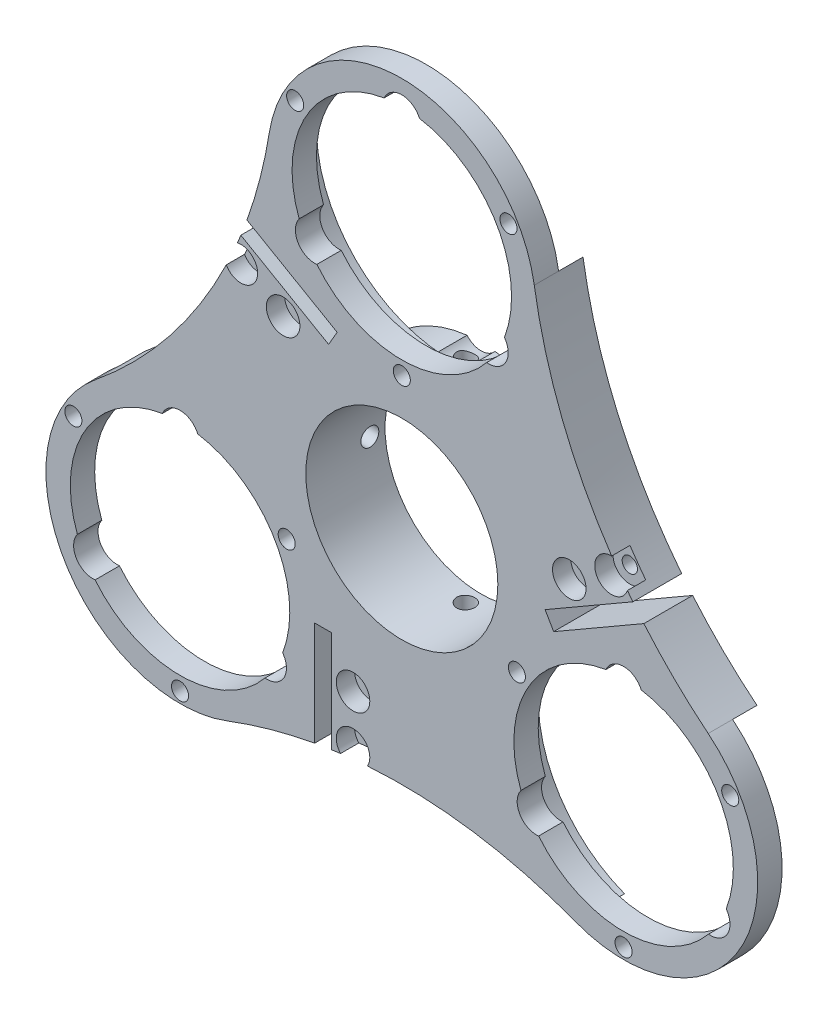
from build123d import *

# Parameters (mm, degrees)
SKETCH_1_R           = 20
SKETCH_1_R_2         = 15.75
EXTRUDE_1_DEPTH      = 5
EXTRUDE_2_DEPTH      = 8
SKETCH_3_R           = 18
EXTRUDE_3_DEPTH      = 12
EXTRUDE_6_DEPTH      = 8
SKETCH_4_R           = 15
CUT_EXTRUDE_1_DEPTH  = 16
SKETCH_7_R           = 2
CUT_EXTRUDE_2_DEPTH  = 10
EXTRUDE_7_REACH      = 92.158
SKETCH_10_W          = 1.475
SKETCH_10_H          = 47.880376143
SKETCH_11_W          = 47.783072431
SKETCH_11_H          = 1.475
SKETCH_14_R          = 15.75
CUT_EXTRUDE_6_DEPTH  = 8
CUT_EXTRUDE_8_DEPTH  = 25
CUT_EXTRUDE_START    = 4
SKETCH_17_R          = 22
CUT_EXTRUDE_9_DEPTH  = 4
SKETCH_18_R          = 1.4
CUT_EXTRUDE_10_DEPTH = 4
SKETCH_19_R          = 3
CUT_EXTRUDE_11_DEPTH = 5
SKETCH_20_R          = 1.25
CUT_EXTRUDE_13_DEPTH = 10
SKETCH_21_R          = 2.75
CUT_EXTRUDE_14_DEPTH = 3
SKETCH_22_W          = 2.8
SKETCH_22_H          = 26.724621274
CUT_EXTRUDE_15_DEPTH = 10


with BuildPart() as part:
    # 草图1 → 凸台-拉伸1 (new body)
    with BuildSketch(Plane.XY):
        Circle(SKETCH_1_R)
        Circle(SKETCH_1_R_2, mode=Mode.SUBTRACT)
    extrude(amount=EXTRUDE_1_DEPTH)

    # 草图2 → 凸台-拉伸2 (add)
    with BuildSketch(Plane.XY.offset(5)):
        with BuildLine():
            ThreePointArc((0, -25.892443989), (42.435244785, -24.5), (22.423514261, 12.946221995))
            ThreePointArc((22.423514261, 12.946221995), (0, 49), (-22.423514261, 12.946221995))
            ThreePointArc((-22.423514261, 12.946221995), (-42.435244785, -24.5), (0, -25.892443989))
        make_face()
    extrude(amount=EXTRUDE_2_DEPTH)

    # 草图3 → 凸台-拉伸3 (add)
    with BuildSketch(Plane.XY.offset(13)):
        with Locations(Location((0, 42, 0), (0, 0, 182.034073739))):
            Circle(SKETCH_3_R)
        with Locations(Location((36.373066959, -21, 0), (0, 0, 237.965926261))):
            Circle(SKETCH_3_R)
        with Locations(Location((-36.373066959, -21, 0), (0, 0, 117.965926261))):
            Circle(SKETCH_3_R)
    extrude(amount=EXTRUDE_3_DEPTH)

    # 草图8 → 凸台-拉伸6 (add)
    with BuildSketch(Plane(origin=(0, 0, 5), x_dir=(-1, 0, 0), z_dir=(0, 0, -1))):
        with BuildLine():
            ThreePointArc((28.527895654, -41.553668461), (55.425625842, -32), (50.250480335, -3.929048123))
            ThreePointArc((50.250480335, -3.929048123), (31.431769398, 18.147140523), (21.72258468, 45.482716583))
            ThreePointArc((21.72258468, 45.482716583), (0, 64), (-21.72258468, 45.482716583))
            ThreePointArc((-21.72258468, 45.482716583), (-31.431769398, 18.147140523), (-50.250480335, -3.929048123))
            ThreePointArc((-50.250480335, -3.929048123), (-55.425625842, -32), (-28.527895654, -41.553668461))
            ThreePointArc((-28.527895654, -41.553668461), (0, -36.294281046), (28.527895654, -41.553668461))
        make_face()
        with BuildLine():
            ThreePointArc((22.423514261, 12.946221995), (42.435244785, -24.5), (0, -25.892443989))
            ThreePointArc((0, -25.892443989), (-42.435244785, -24.5), (-22.423514261, 12.946221995))
            ThreePointArc((-22.423514261, 12.946221995), (0, 49), (22.423514261, 12.946221995))
        make_face(mode=Mode.SUBTRACT)
    extrude(amount=-EXTRUDE_6_DEPTH)

    # 草图4 → 切除-拉伸1 (cut)
    with BuildSketch(Plane.XY.offset(25)):
        with Locations((0, 42)):
            Circle(SKETCH_4_R)
        with Locations((36.373066959, -21)):
            Circle(SKETCH_4_R)
        with Locations((-36.373066959, -21)):
            Circle(SKETCH_4_R)
    extrude(amount=-CUT_EXTRUDE_1_DEPTH, mode=Mode.SUBTRACT)

    # 草图7 → 切除-拉伸2 (cut)
    with BuildSketch(Plane.XY.offset(9)):
        with Locations((0, 42)):
            Circle(SKETCH_7_R)
        with Locations((36.373066959, -21)):
            Circle(SKETCH_7_R)
        with Locations((-36.373066959, -21)):
            Circle(SKETCH_7_R)
    extrude(amount=-CUT_EXTRUDE_2_DEPTH, mode=Mode.SUBTRACT)

    # 草图6 → 凸台-拉伸7 (add, up to next)
    with BuildSketch(Plane.XY.offset(25), mode=Mode.PRIVATE) as extrude_7_sk1:
        with BuildLine():
            ThreePointArc((2.644358031, 56.765072658), (0, 61.66268909), (-2.644358031, 56.765072658))
            ThreePointArc((-2.644358031, 56.765072658), (0, 57), (2.644358031, 56.765072658))
        make_face()
    extrude_7_tool1 = extrude(extrude_7_sk1.sketch, amount=-EXTRUDE_7_REACH, mode=Mode.PRIVATE) - part.part
    # 草图6 → 凸台-拉伸7 (add, up to next)
    with BuildSketch(Plane.XY.offset(25), mode=Mode.PRIVATE) as extrude_7_sk2:
        with BuildLine():
            ThreePointArc((11.464748995, 32.327382439), (17.028388258, 32.168655455), (14.109107026, 36.907544902))
            ThreePointArc((14.109107026, 36.907544902), (12.990381057, 34.5), (11.464748995, 32.327382439))
        make_face()
    extrude_7_tool2 = extrude(extrude_7_sk2.sketch, amount=-EXTRUDE_7_REACH, mode=Mode.PRIVATE) - part.part
    # 草图6 → 凸台-拉伸7 (add, up to next)
    with BuildSketch(Plane.XY.offset(25), mode=Mode.PRIVATE) as extrude_7_sk3:
        with BuildLine():
            ThreePointArc((-14.109107026, 36.907544902), (-17.028388258, 32.168655455), (-11.464748995, 32.327382439))
            ThreePointArc((-11.464748995, 32.327382439), (-12.990381057, 34.5), (-14.109107026, 36.907544902))
        make_face()
    extrude_7_tool3 = extrude(extrude_7_sk3.sketch, amount=-EXTRUDE_7_REACH, mode=Mode.PRIVATE) - part.part
    # 草图6 → 凸台-拉伸7 (add, up to next)
    with BuildSketch(Plane.XY.offset(25), mode=Mode.PRIVATE) as extrude_7_sk4:
        with BuildLine():
            ThreePointArc((47.837815954, -30.672617561), (53.401455217, -30.831344545), (50.482173985, -26.092455098))
            ThreePointArc((50.482173985, -26.092455098), (49.363448016, -28.5), (47.837815954, -30.672617561))
        make_face()
    extrude_7_tool4 = extrude(extrude_7_sk4.sketch, amount=-EXTRUDE_7_REACH, mode=Mode.PRIVATE) - part.part
    # 草图6 → 凸台-拉伸7 (add, up to next)
    with BuildSketch(Plane.XY.offset(25), mode=Mode.PRIVATE) as extrude_7_sk5:
        with BuildLine():
            ThreePointArc((22.263959933, -26.092455098), (19.344678701, -30.831344545), (24.908317964, -30.672617561))
            ThreePointArc((24.908317964, -30.672617561), (23.382685902, -28.5), (22.263959933, -26.092455098))
        make_face()
    extrude_7_tool5 = extrude(extrude_7_sk5.sketch, amount=-EXTRUDE_7_REACH, mode=Mode.PRIVATE) - part.part
    # 草图6 → 凸台-拉伸7 (add, up to next)
    with BuildSketch(Plane.XY.offset(25), mode=Mode.PRIVATE) as extrude_7_sk6:
        with BuildLine():
            ThreePointArc((39.01742499, -6.234927342), (36.373066959, -1.33731091), (33.728708928, -6.234927342))
            ThreePointArc((33.728708928, -6.234927342), (36.373066959, -6), (39.01742499, -6.234927342))
        make_face()
    extrude_7_tool6 = extrude(extrude_7_sk6.sketch, amount=-EXTRUDE_7_REACH, mode=Mode.PRIVATE) - part.part
    # 草图6 → 凸台-拉伸7 (add, up to next)
    with BuildSketch(Plane.XY.offset(25), mode=Mode.PRIVATE) as extrude_7_sk7:
        with BuildLine():
            ThreePointArc((-50.482173985, -26.092455098), (-53.401455217, -30.831344545), (-47.837815954, -30.672617561))
            ThreePointArc((-47.837815954, -30.672617561), (-49.363448016, -28.5), (-50.482173985, -26.092455098))
        make_face()
    extrude_7_tool7 = extrude(extrude_7_sk7.sketch, amount=-EXTRUDE_7_REACH, mode=Mode.PRIVATE) - part.part
    # 草图6 → 凸台-拉伸7 (add, up to next)
    with BuildSketch(Plane.XY.offset(25), mode=Mode.PRIVATE) as extrude_7_sk8:
        with BuildLine():
            ThreePointArc((-33.728708928, -6.234927342), (-36.373066959, -1.33731091), (-39.01742499, -6.234927342))
            ThreePointArc((-39.01742499, -6.234927342), (-36.373066959, -6), (-33.728708928, -6.234927342))
        make_face()
    extrude_7_tool8 = extrude(extrude_7_sk8.sketch, amount=-EXTRUDE_7_REACH, mode=Mode.PRIVATE) - part.part
    # 草图6 → 凸台-拉伸7 (add, up to next)
    with BuildSketch(Plane.XY.offset(25), mode=Mode.PRIVATE) as extrude_7_sk9:
        with BuildLine():
            ThreePointArc((-24.908317964, -30.672617561), (-19.344678701, -30.831344545), (-22.263959933, -26.092455098))
            ThreePointArc((-22.263959933, -26.092455098), (-23.382685902, -28.5), (-24.908317964, -30.672617561))
        make_face()
    extrude_7_tool9 = extrude(extrude_7_sk9.sketch, amount=-EXTRUDE_7_REACH, mode=Mode.PRIVATE) - part.part
    add(extrude_7_tool1.solids().sort_by_distance((0, 59.041522, 25))[0])
    add(extrude_7_tool2.solids().sort_by_distance((14.758391, 33.479239, 25))[0])
    add(extrude_7_tool3.solids().sort_by_distance((-14.758391, 33.479239, 25))[0])
    add(extrude_7_tool4.solids().sort_by_distance((51.131457, -29.520761, 25))[0])
    add(extrude_7_tool5.solids().sort_by_distance((21.614676, -29.520761, 25))[0])
    add(extrude_7_tool6.solids().sort_by_distance((36.373067, -3.958478, 25))[0])
    add(extrude_7_tool7.solids().sort_by_distance((-51.131457, -29.520761, 25))[0])
    add(extrude_7_tool8.solids().sort_by_distance((-36.373067, -3.958478, 25))[0])
    add(extrude_7_tool9.solids().sort_by_distance((-21.614676, -29.520761, 25))[0])

    # 草图10 → 切除-旋转1 (revolve, cut)
    with BuildSketch(Plane(origin=(0, 0, 2.5), x_dir=(-1, 0, 0), z_dir=(0, 0, -1)), mode=Mode.PRIVATE) as cut_revolve_1_sk:
        with Locations((0.7375, -0.269128361)):
            Rectangle(SKETCH_10_W, SKETCH_10_H)
    revolve(cut_revolve_1_sk.sketch.rotate(Axis((0, 26.597082696, 2.5), (0, -1, 0)), 270), axis=Axis((0, 26.597082696, 2.5), (0, -1, 0)), mode=Mode.SUBTRACT)

    # 草图11 → 切除-旋转2 (revolve, cut)
    with BuildSketch(Plane(origin=(0, 0, 2.5), x_dir=(-1, 0, 0), z_dir=(0, 0, -1)), mode=Mode.PRIVATE) as cut_revolve_2_sk:
        with Locations((0.227220258, 0.7375)):
            Rectangle(SKETCH_11_W, SKETCH_11_H)
    revolve(cut_revolve_2_sk.sketch.rotate(Axis((35.344622551, 0, 2.5), (-1, 0, 0)), 90), axis=Axis((35.344622551, 0, 2.5), (-1, 0, 0)), mode=Mode.SUBTRACT)

    # 草图14 → 切除-拉伸6 (cut)
    with BuildSketch(Plane(origin=(0, 0, 5), x_dir=(-1, 0, 0), z_dir=(0, 0, -1))):
        with Locations(Location((0, 0, 0), (0, 0, 180))):
            Circle(SKETCH_14_R)
    extrude(amount=-CUT_EXTRUDE_6_DEPTH, mode=Mode.SUBTRACT)

    # 草图16 → 切除-拉伸8 (cut, symmetric)
    with BuildSketch(Plane.XY.offset(13)):
        with BuildLine():
            ThreePointArc((-2.89865373, 59.765072658), (-15.588457268, 51), (-16.834331087, 35.627771438))
            ThreePointArc((-16.834331087, 35.627771438), (-17.028388258, 32.168655455), (-13.935677357, 30.607155904))
            ThreePointArc((-13.935677357, 30.607155904), (0, 24), (13.935677357, 30.607155904))
            ThreePointArc((13.935677357, 30.607155904), (17.028388258, 32.168655455), (16.834331087, 35.627771438))
            ThreePointArc((16.834331087, 35.627771438), (15.588457268, 51), (2.89865373, 59.765072658))
            ThreePointArc((2.89865373, 59.765072658), (0, 61.66268909), (-2.89865373, 59.765072658))
        make_face()
        with BuildLine():
            ThreePointArc((53.207398046, -27.372228562), (51.961524227, -12), (39.271720689, -3.234927342))
            ThreePointArc((39.271720689, -3.234927342), (36.373066959, -1.33731091), (33.474413229, -3.234927342))
            ThreePointArc((33.474413229, -3.234927342), (20.784609691, -12), (19.538735872, -27.372228562))
            ThreePointArc((19.538735872, -27.372228562), (19.344678701, -30.831344545), (22.437389602, -32.392844096))
            ThreePointArc((22.437389602, -32.392844096), (36.373066959, -39), (50.308744316, -32.392844096))
            ThreePointArc((50.308744316, -32.392844096), (53.401455217, -30.831344545), (53.207398046, -27.372228562))
        make_face()
        with BuildLine():
            ThreePointArc((-50.308744316, -32.392844096), (-36.373066959, -39), (-22.437389602, -32.392844096))
            ThreePointArc((-22.437389602, -32.392844096), (-19.344678701, -30.831344545), (-19.538735872, -27.372228562))
            ThreePointArc((-19.538735872, -27.372228562), (-20.784609691, -12), (-33.474413229, -3.234927342))
            ThreePointArc((-33.474413229, -3.234927342), (-36.373066959, -1.33731091), (-39.271720689, -3.234927342))
            ThreePointArc((-39.271720689, -3.234927342), (-51.961524227, -12), (-53.207398046, -27.372228562))
            ThreePointArc((-53.207398046, -27.372228562), (-53.401455217, -30.831344545), (-50.308744316, -32.392844096))
        make_face()
    extrude(amount=CUT_EXTRUDE_8_DEPTH, both=True, mode=Mode.SUBTRACT)

    # 草图17 → 切除-拉伸9 (cut)
    with BuildSketch(Plane(origin=(0, 0, 9), x_dir=(-1, 0, 0), z_dir=(0, 0, -1)).offset(CUT_EXTRUDE_START)):
        with Locations((0, 42)):
            Circle(SKETCH_17_R)
        with Locations((36.373066959, -21)):
            Circle(SKETCH_17_R)
        with Locations((-36.373066959, -21)):
            Circle(SKETCH_17_R)
    extrude(amount=-CUT_EXTRUDE_9_DEPTH, mode=Mode.SUBTRACT)

    # 草图18 → 切除-拉伸10 (cut)
    with BuildSketch(Plane(origin=(0, 0, 9), x_dir=(-1, 0, 0), z_dir=(0, 0, -1))):
        with Locations((0, 21.8)):
            Circle(SKETCH_18_R)
        with Locations((-17.493713156, 52.1)):
            Circle(SKETCH_18_R)
        with Locations((17.493713156, 52.1)):
            Circle(SKETCH_18_R)
        with Locations((53.866780115, -10.9)):
            Circle(SKETCH_18_R)
        with Locations((36.373066959, -41.2)):
            Circle(SKETCH_18_R)
        with Locations((18.879353803, -10.9)):
            Circle(SKETCH_18_R)
        with Locations((-36.373066959, -41.2)):
            Circle(SKETCH_18_R)
        with Locations((-53.866780115, -10.9)):
            Circle(SKETCH_18_R)
        with Locations((-18.879353802, -10.9)):
            Circle(SKETCH_18_R)
    extrude(amount=-CUT_EXTRUDE_10_DEPTH, mode=Mode.SUBTRACT)

    # 草图19 → 切除-拉伸11 (cut)
    with BuildSketch(Plane(origin=(0, 0, 0), x_dir=(-1, 0, 0), z_dir=(0, 0, -1))):
        with Locations((0, 21.8)):
            Circle(SKETCH_19_R)
        with Locations((18.879353803, -10.9)):
            Circle(SKETCH_19_R)
        with Locations((-18.879353802, -10.9)):
            Circle(SKETCH_19_R)
    extrude(amount=-CUT_EXTRUDE_11_DEPTH, mode=Mode.SUBTRACT)

    # 草图20 → 切除-拉伸13 (cut)
    with BuildSketch(Plane(origin=(0, 0, 5), x_dir=(-1, 0, 0), z_dir=(0, 0, -1))):
        with Locations((8, -35.096730742)):
            Circle(SKETCH_20_R)
        with Locations((8, -27.096730742)):
            Circle(SKETCH_20_R)
        with Locations((-27.466457182, 6.620162141)):
            Circle(SKETCH_20_R)
        with Locations((-34.394660412, 10.620162141)):
            Circle(SKETCH_20_R)
        with Locations((19.466457182, 20.476568601)):
            Circle(SKETCH_20_R)
        with Locations((26.394660412, 24.476568601)):
            Circle(SKETCH_20_R)
    extrude(amount=-CUT_EXTRUDE_13_DEPTH, mode=Mode.SUBTRACT)

    # 草图21 → 切除-拉伸14 (cut)
    with BuildSketch(Plane.XY.offset(13)):
        with Locations((-8, -35.096730742)):
            Circle(SKETCH_21_R)
        with Locations((-8, -27.096730742)):
            Circle(SKETCH_21_R)
        with Locations((-26.394660412, 24.476568601)):
            Circle(SKETCH_21_R)
        with Locations((-19.466457182, 20.476568601)):
            Circle(SKETCH_21_R)
        with Locations((34.394660412, 10.620162141)):
            Circle(SKETCH_21_R)
        with Locations((27.466457182, 6.620162141)):
            Circle(SKETCH_21_R)
    extrude(amount=-CUT_EXTRUDE_14_DEPTH, mode=Mode.SUBTRACT)

    # 草图22 → 切除-拉伸15 (cut)
    with BuildSketch(Plane.XY.offset(13)):
        with Locations((-12.9, -33.862310637)):
            Rectangle(SKETCH_22_W, SKETCH_22_H)
        Polygon((-33.747721707, 35.996473911), (-10.603520778, 22.634163274), (-12.003520778, 20.209292144), (-35.147721707, 33.57160278), align=None)
        Polygon((48.047721707, 11.228147363), (24.903520778, -2.134163274), (23.503520778, 0.290707856), (46.647721707, 13.653018493), align=None)
    extrude(amount=-CUT_EXTRUDE_15_DEPTH, mode=Mode.SUBTRACT)


solid = part.part
